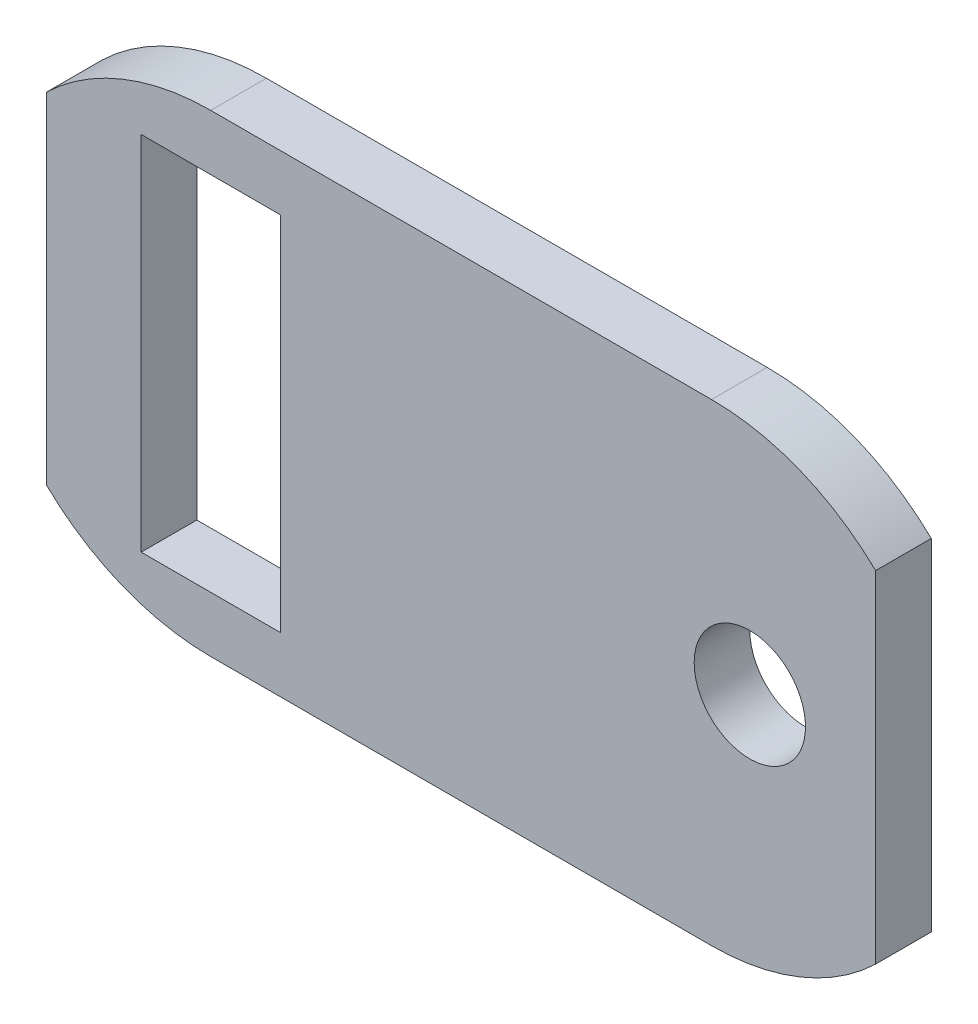
from build123d import *

# Parameters (mm, degrees)
BOSS_EXTRUDE1_DEPTH = 10
SKETCH2_W           = 25
SKETCH2_H           = 65
CUT_EXTRUDE2_DEPTH  = 20
SKETCH3_R           = 10
CUT_EXTRUDE3_DEPTH  = 20


with BuildPart() as part:
    # Sketch1 → Boss-Extrude1 (new body)
    with BuildSketch(Plane.XY):
        with BuildLine():
            Line((-80.798103543, 3.150277686), (-80.798103543, -58.088380877))
            ThreePointArc((-80.798103543, -58.088380877), (-67.213396938, -66.887140682), (-51.324273213, -69.969051596))
            Line((-51.324273213, -69.969051596), (38.675726787, -69.969051596))
            ThreePointArc((38.675726787, -69.969051596), (54.564850513, -66.887140682), (68.149557118, -58.088380877))
            Line((68.149557118, -58.088380877), (68.149557118, 3.150277686))
            ThreePointArc((68.149557118, 3.150277686), (54.564850513, 11.949037491), (38.675726787, 15.030948404))
            Line((38.675726787, 15.030948404), (-51.324273213, 15.030948404))
            ThreePointArc((-51.324273213, 15.030948404), (-67.213396938, 11.949037491), (-80.798103543, 3.150277686))
        make_face()
    extrude(amount=BOSS_EXTRUDE1_DEPTH)

    # Sketch2 → Cut-Extrude2 (cut)
    with BuildSketch(Plane(origin=(0, 0, 0), x_dir=(-1, 0, 0), z_dir=(0, 0, -1))):
        with Locations((51.324273213, -27.469051596)):
            Rectangle(SKETCH2_W, SKETCH2_H)
    extrude(amount=-CUT_EXTRUDE2_DEPTH, mode=Mode.SUBTRACT)

    # Sketch3 → Cut-Extrude3 (cut)
    with BuildSketch(Plane(origin=(0, 0, 0), x_dir=(-1, 0, 0), z_dir=(0, 0, -1))):
        with Locations((-45.543981451, -27.469051596)):
            Circle(SKETCH3_R)
    extrude(amount=-CUT_EXTRUDE3_DEPTH, mode=Mode.SUBTRACT)


solid = part.part
